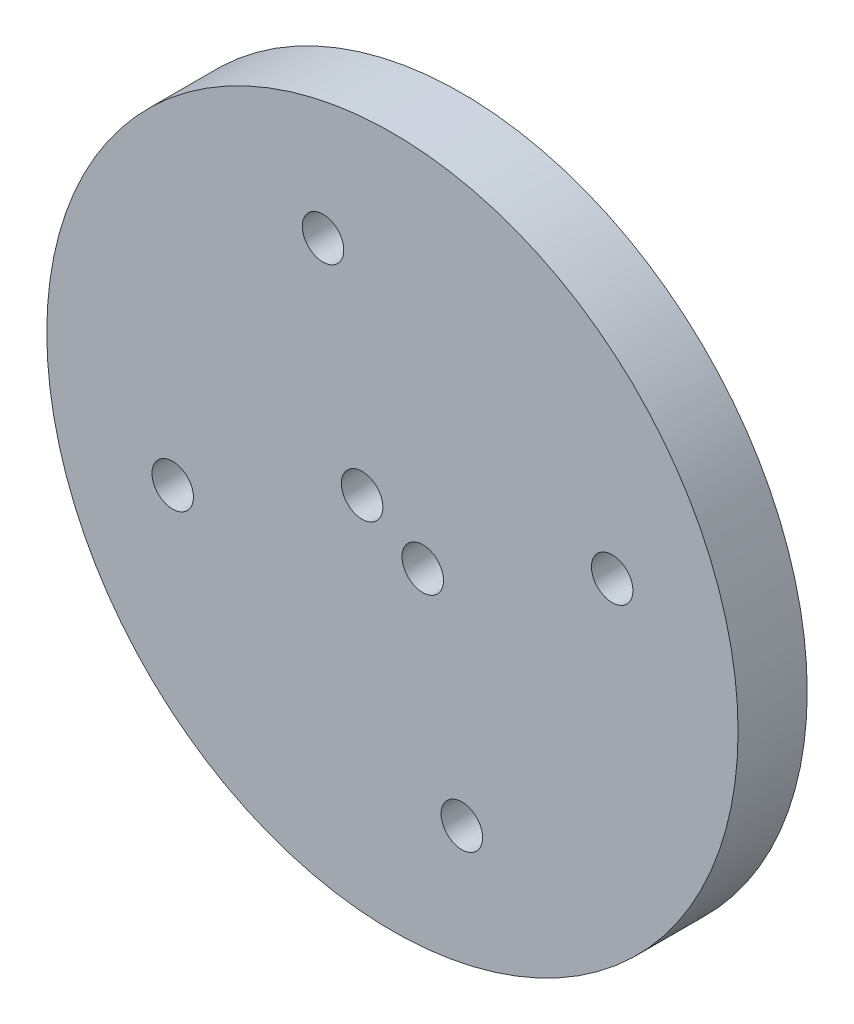
from build123d import *

# Parameters (mm, degrees)
SKETCH1_R           = 15
BOSS_EXTRUDE1_DEPTH = 3
SKETCH2_R           = 0.9
CUT_EXTRUDE1_DEPTH  = 3


with BuildPart() as part:
    # Sketch1 → Boss-Extrude1 (new body)
    with BuildSketch(Plane.XY):
        Circle(SKETCH1_R)
    extrude(amount=BOSS_EXTRUDE1_DEPTH)

    # Sketch2 → Cut-Extrude1 (cut)
    with BuildSketch(Plane(origin=(0, 0, 0), x_dir=(-1, 0, 0), z_dir=(0, 0, -1))):
        with Locations((-1.31599788, -0.719826076)):
            Circle(SKETCH2_R)
        with Locations((1.31599788, 0.719826076)):
            Circle(SKETCH2_R)
        with Locations((-3.011222811, -9.535855346)):
            Circle(SKETCH2_R)
        with Locations((-9.535855346, 3.011222811)):
            Circle(SKETCH2_R)
        with Locations((3.011222811, 9.535855346)):
            Circle(SKETCH2_R)
        with Locations((9.535855346, -3.011222811)):
            Circle(SKETCH2_R)
    extrude(amount=-CUT_EXTRUDE1_DEPTH, mode=Mode.SUBTRACT)


solid = part.part
